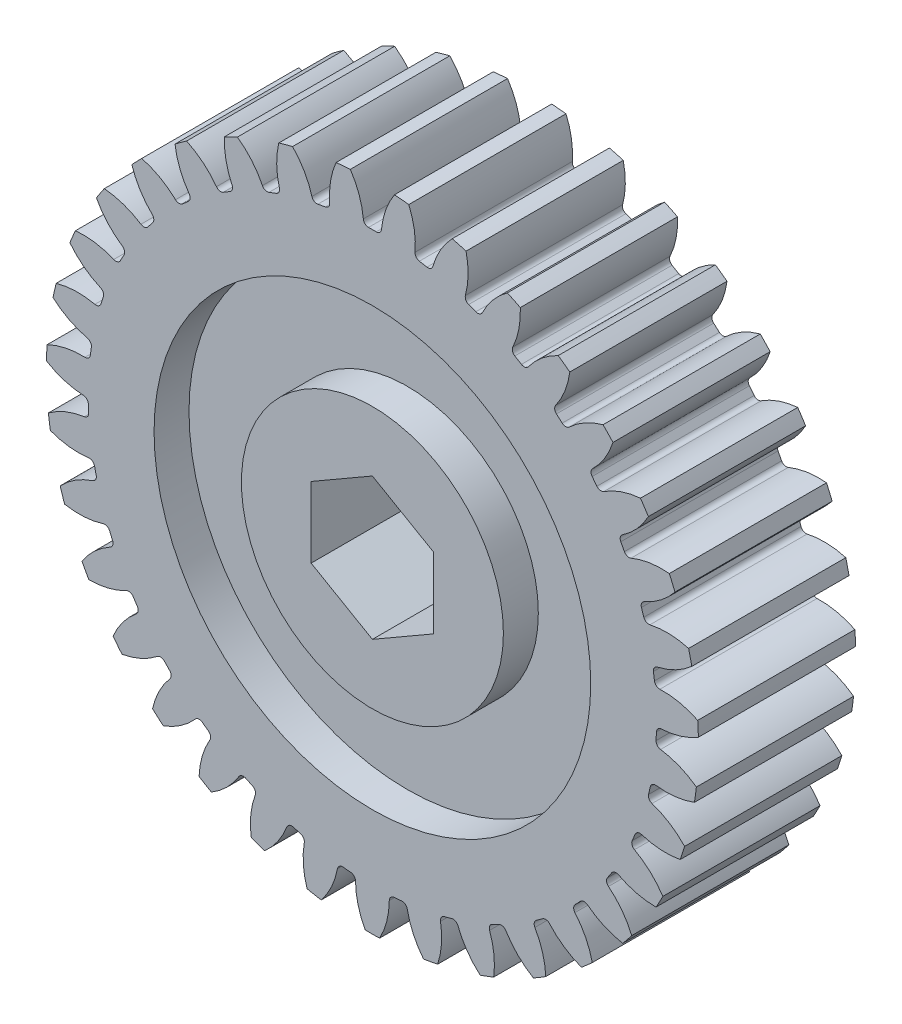
from build123d import *

# Parameters (mm, degrees)
SKIZZE1_R                       = 18.6665
AUFSATZ_LINEAR_AUSTRAGEN1_DEPTH = 4.5
SKIZZE4_R                       = 12.5
SKIZZE4_R_2                     = 7.5
SCHNITT_LINEAR_AUSTRAGEN2_DEPTH = 2
SCHNITT_LINEAR_AUSTRAGEN3_DEPTH = 28.890436434
KREISMUSTER1_COUNT              = 35
SKIZZE8_R                       = 6
AUFSATZ_LINEAR_AUSTRAGEN2_DEPTH = 1
SCHNITT_LINEAR_AUSTRAGEN4_DEPTH = 29.225773279


with BuildPart() as part:
    # Skizze1 → Aufsatz-Linear austragen1 (new, symmetric)
    with BuildSketch(Plane.XY):
        Circle(SKIZZE1_R)
    extrude(amount=AUFSATZ_LINEAR_AUSTRAGEN1_DEPTH, both=True)

    # Skizze4 → Schnitt-Linear austragen2 (cut)
    with BuildSketch(Plane.XY.offset(4.5)):
        Circle(SKIZZE4_R)
        Circle(SKIZZE4_R_2, mode=Mode.SUBTRACT)
    extrude(amount=-SCHNITT_LINEAR_AUSTRAGEN2_DEPTH, mode=Mode.SUBTRACT)

    # Skizze6 → Schnitt-Linear austragen3 (cut, through all)
    with BuildSketch(Plane.XY.offset(4.5)):
        with BuildLine():
            Line((-0.219874756, 16.267), (0.219874756, 16.267))
            ThreePointArc((0.219874756, 16.267), (0.421386888, 16.344754953), (0.518441911, 16.537714262))
            ThreePointArc((0.518441911, 16.537714262), (1.009154991, 18.192876188), (2.08, 19.547))
            ThreePointArc((2.08, 19.547), (0, 19.667581665), (-2.08, 19.547))
            ThreePointArc((-2.08, 19.547), (-1.009154991, 18.192876188), (-0.518441911, 16.537714262))
            ThreePointArc((-0.518441911, 16.537714262), (-0.421386888, 16.344754953), (-0.219874756, 16.267))
        make_face()
    schnitt_linear_austragen3 = extrude(amount=-SCHNITT_LINEAR_AUSTRAGEN3_DEPTH, mode=Mode.SUBTRACT)

    # Kreismuster1: Schnitt-Linear austragen3 ×35 about axis
    kreismuster1_axis = Axis((0, 0, 0), (0, 0, 1))
    for i in range(1, KREISMUSTER1_COUNT):
        add(schnitt_linear_austragen3.rotate(kreismuster1_axis, i * 360 / KREISMUSTER1_COUNT), mode=Mode.SUBTRACT)

    # Skizze8 → Aufsatz-Linear austragen2 (add)
    with BuildSketch(Plane(origin=(0, 0, -4.5), x_dir=(-1, 0, 0), z_dir=(0, 0, -1))):
        with Locations(Location((0, 0, 0), (0, 0, 180))):
            Circle(SKIZZE8_R)
    extrude(amount=AUFSATZ_LINEAR_AUSTRAGEN2_DEPTH)

    # Skizze7 → Schnitt-Linear austragen4 (cut, through all)
    with BuildSketch(Plane.XY.offset(4.5)):
        Polygon((0, 4.05), (-3.507402885, 2.025), (-3.507402885, -2.025), (0, -4.05), (3.507402885, -2.025), (3.507402885, 2.025), align=None)
    extrude(amount=-SCHNITT_LINEAR_AUSTRAGEN4_DEPTH, mode=Mode.SUBTRACT)


solid = part.part
